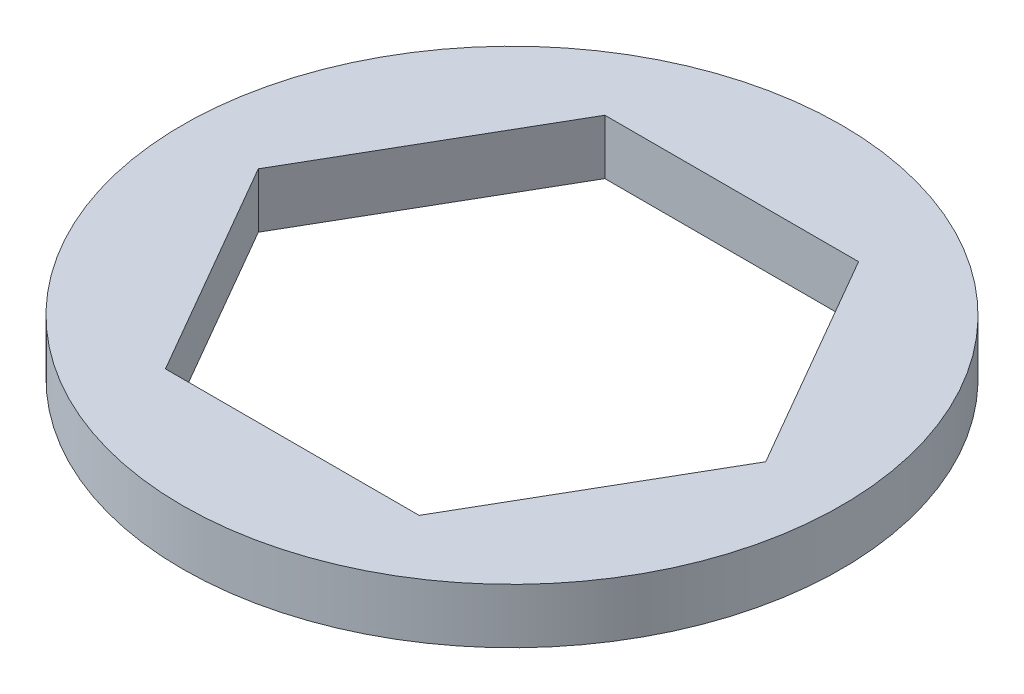
from build123d import *

# Parameters (mm, degrees)
SKETCH1_R           = 9.525
BOSS_EXTRUDE1_DEPTH = 1.5875


with BuildPart() as part:
    # Sketch1 → Boss-Extrude1 (new body)
    with BuildSketch(Plane(origin=(0, 0, 0), x_dir=(1, 0, 0), z_dir=(0, 1, 0))):
        with Locations(Location((0, 0, 0), (0, 0, 270))):
            Circle(SKETCH1_R)
        Polygon((7.332348419, 0), (3.666174209, 6.35), (-3.666174209, 6.35), (-7.332348419, 0), (-3.666174209, -6.35), (3.666174209, -6.35), align=None, mode=Mode.SUBTRACT)
    extrude(amount=BOSS_EXTRUDE1_DEPTH)


solid = part.part
